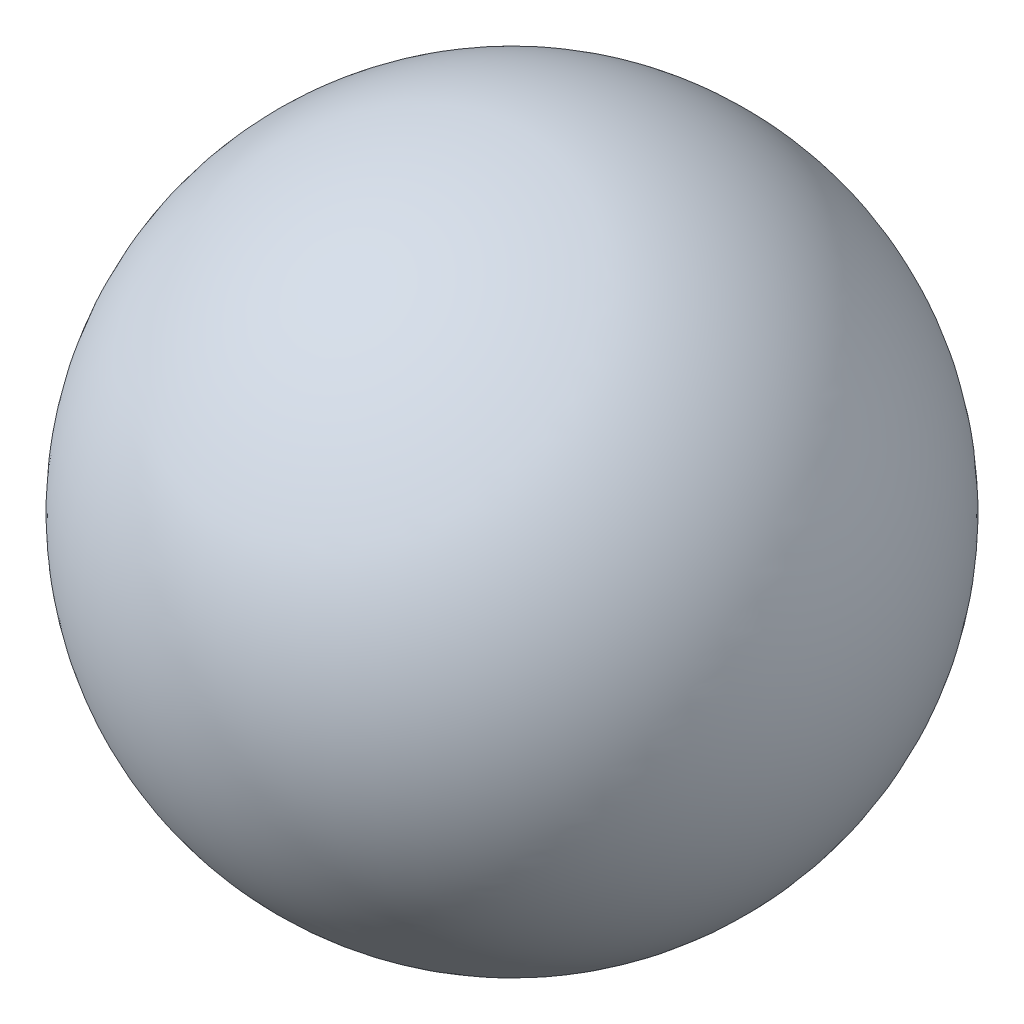
from build123d import *


with BuildPart() as part:
    # Sketch1 → Revolve1 (revolve)
    with BuildSketch(Plane.XY):
        with BuildLine():
            Line((0, -282.094791774), (0, 282.094791774))
            add(Edge.make_bspline(
                [(0, -282.094791774), (0.275206568, -282.094791774), (0.819956692, -282.093764219), (1.970225379, -282.089140222), (3.321850848, -282.076809699), (4.612568599, -282.05831425), (5.931376836, -282.033654281), (7.583792665, -281.995124342), (9.558752506, -281.9365618), (11.866211728, -281.850266055), (14.500368228, -281.727002587), (17.13413495, -281.579110134), (19.76594703, -281.406601626), (22.396270869, -281.209492144), (25.681587428, -280.932375612), (29.619663271, -280.550707052), (34.206660174, -280.033875191), (40.744585928, -279.173141805), (53.774450194, -277.126071827), (70.552170767, -273.516509009), (90.82113058, -267.539646799), (112.939031132, -258.859010277), (131.967789435, -249.695243355), (150.258529121, -239.135080554), (167.708963393, -227.237574768), (184.221499674, -214.069267951), (199.703796323, -199.703793926), (214.06926586, -184.221502979), (227.237577082, -167.708958357), (239.135077427, -150.2585371), (249.695247269, -131.967777279), (261.149944281, -108.181867069), (270.19193556, -83.343174485), (276.713225512, -57.726948535), (280.647991016, -31.621446631), (282.226321112, -10.560156196), (282.226317328, 10.56015911), (280.647995596, 31.621437497), (277.500172693, 52.505863868), (272.800458541, 73.09666353), (266.575132175, 93.27867251), (258.859010389, 112.939032043), (249.695243486, 131.967789043), (239.135079833, 150.258529633), (227.237575579, 167.708962981), (214.069266813, 184.221500118), (199.703795682, 199.703795729), (184.221500167, 214.06926675), (167.708962898, 227.237575685), (150.25852908, 239.135079983), (131.967788912, 249.695243694), (112.939031248, 258.859010376), (93.278672694, 266.575132452), (73.096661822, 272.800458262), (56.366638742, 276.618976634), (43.359752543, 278.828848452), (34.206663179, 280.033875191), (29.619657099, 280.550707053), (25.681597957, 280.932375612), (22.396252568, 281.209492145), (19.765986493, 281.406601626), (17.134061121, 281.579110134), (14.500502217, 281.727002587), (12.195278269, 281.834858122), (10.21826997, 281.911905873), (8.571059186, 281.965843071), (7.253467683, 282.00283033), (5.765823792, 282.037507275), (4.44851344, 282.061139914), (3.3238672, 282.076424399), (2.293220165, 282.085672267), (1.400577136, 282.091452221), (0.684223221, 282.094021108), (0.275206568, 282.094791774), (0, 282.094791774)],
                knots=[0.082637729, 0.082637729, 0.082637729, 0.082637729, 0.082637729, 0.083879879, 0.085122028, 0.086364178, 0.087606328, 0.088848477, 0.090090627, 0.092574926, 0.095059225, 0.097543524, 0.100027824, 0.102512123, 0.104996422, 0.107480721, 0.11244932, 0.117417918, 0.122386517, 0.132323714, 0.162135304, 0.182009698, 0.201884092, 0.221758486, 0.24163288, 0.261507274, 0.281381668, 0.301256061, 0.321130455, 0.341004849, 0.360879243, 0.380753637, 0.400628031, 0.440376818, 0.460251212, 0.480125606, 0.5, 0.519874394, 0.539748788, 0.559623182, 0.579497575, 0.599371969, 0.619246363, 0.639120757, 0.658995151, 0.678869545, 0.698743939, 0.718618332, 0.738492726, 0.75836712, 0.778241514, 0.798115908, 0.817990302, 0.837864696, 0.857739089, 0.877613483, 0.882582082, 0.88755068, 0.892519279, 0.895003578, 0.897487877, 0.899972176, 0.902456476, 0.904940775, 0.907425074, 0.908667224, 0.909909373, 0.911151523, 0.912393672, 0.914256897, 0.914877972, 0.915499047, 0.916120121, 0.917362271, 0.917362271, 0.917362271, 0.917362271, 0.917362271], degree=4))
        make_face()
    revolve(axis=Axis((0, 282.094791774, 0), (0, -1, 0)))


solid = part.part
